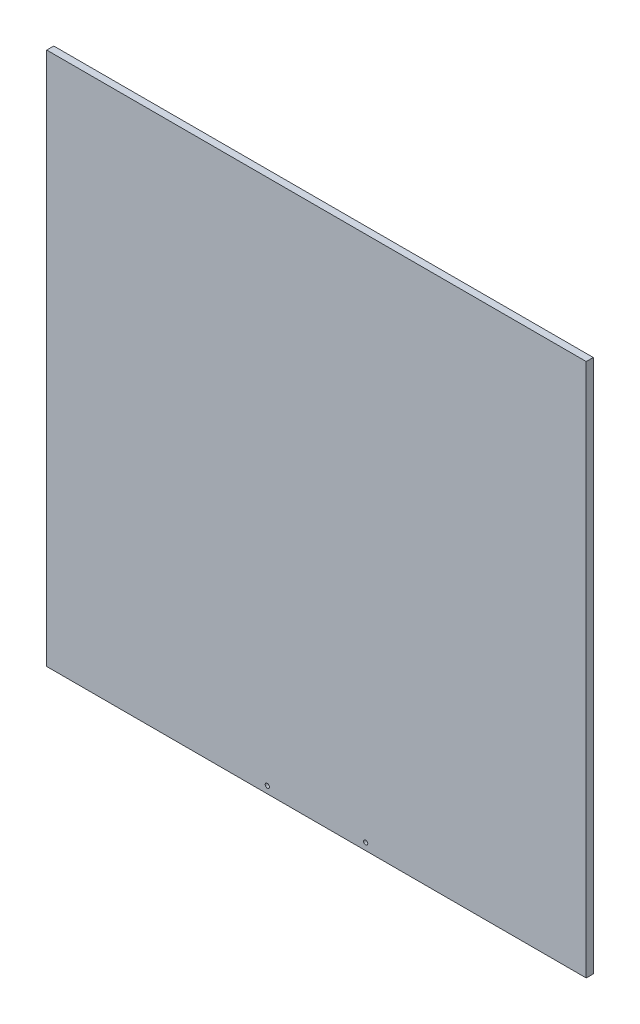
from build123d import *

# Parameters (mm, degrees)
BOSS_EXTRU_1_DEPTH      = 5
ESQUISSE3_R             = 1.5
ENL_V_MAT_EXTRU_2_DEPTH = 271.164764542


with BuildPart() as part:
    # Esquisse1 → Boss.-Extru.1 (new body)
    with BuildSketch(Plane.XY):
        Polygon((-192, 190), (192, 190), (192, 97.5), (192, -107.5), (192, -190), (-192, -190), (-192, -87.5), (-192, 97.5), align=None)
    extrude(amount=BOSS_EXTRU_1_DEPTH)

    # Esquisse3 → Enlèv. mat.-Extru.2 (cut, through all)
    with BuildSketch(Plane(origin=(0, 0, 0), x_dir=(-1, 0, 0), z_dir=(0, 0, -1))):
        with Locations((35, -185)):
            Circle(ESQUISSE3_R)
        with Locations((-35, -185)):
            Circle(ESQUISSE3_R)
    extrude(amount=-ENL_V_MAT_EXTRU_2_DEPTH, mode=Mode.SUBTRACT)


solid = part.part
